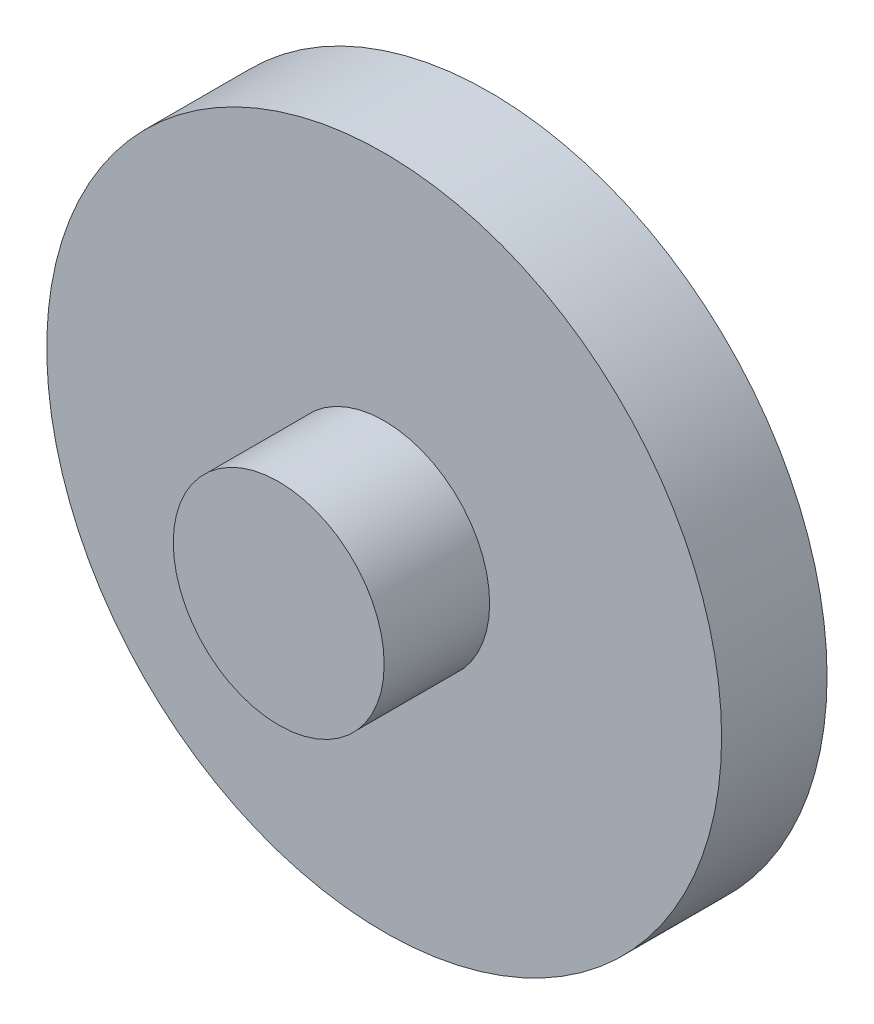
from build123d import *

# Parameters (mm, degrees)
SKETCH_1_R      = 32
EXTRUDE_1_DEPTH = 10
SKETCH_2_R      = 10
EXTRUDE_2_DEPTH = 10


with BuildPart() as part:
    # 草图1 → 凸台-拉伸1 (new body)
    with BuildSketch(Plane.XY):
        Circle(SKETCH_1_R)
    extrude(amount=EXTRUDE_1_DEPTH)

    # 草图2 → 凸台-拉伸2 (add)
    with BuildSketch(Plane.XY.offset(10)):
        Circle(SKETCH_2_R)
    extrude(amount=EXTRUDE_2_DEPTH)


solid = part.part
